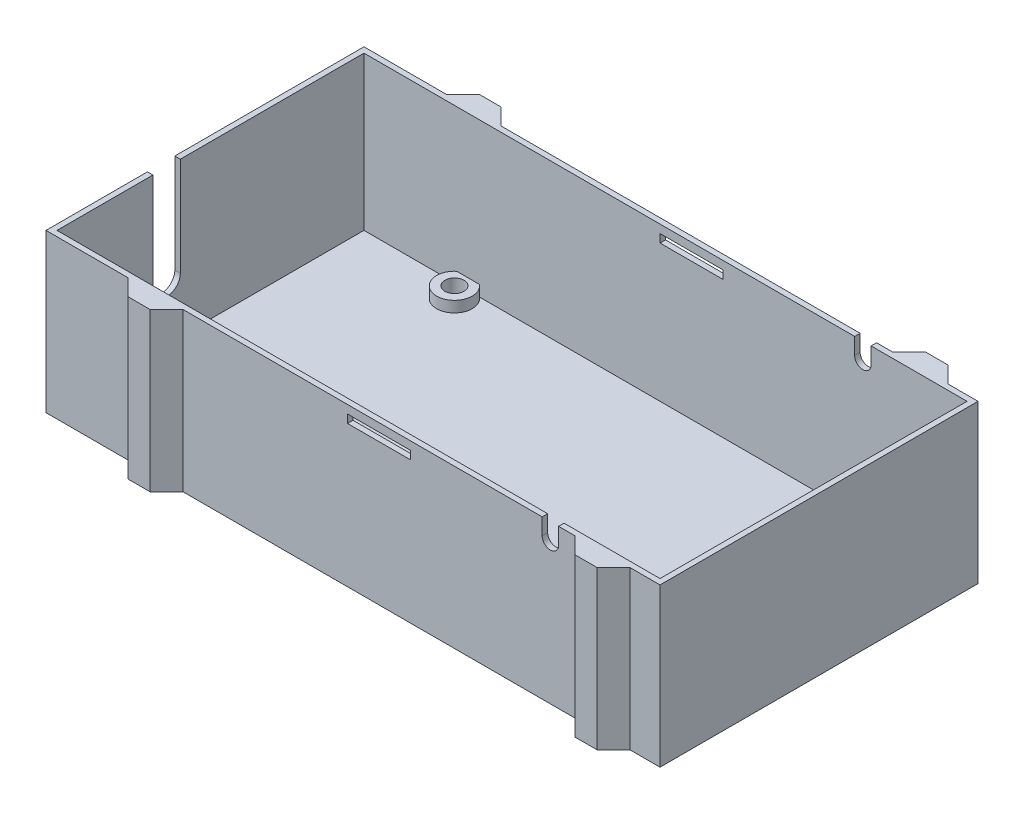
from build123d import *

# Parameters (mm, degrees)
SKETCH1_W           = 112
SKETCH1_H           = 58
BOSS_EXTRUDE1_DEPTH = 0.8
SKETCH2_W           = 112
SKETCH2_H           = 58
SKETCH2_W_2         = 110
SKETCH2_H_2         = 56
BOSS_EXTRUDE2_DEPTH = 28
SKETCH3_R           = 1.75
CUT_EXTRUDE1_DEPTH  = 28
BOSS_EXTRUDE3_START = 2
SKETCH4_R           = 3.25
SKETCH4_R_2         = 1.75
BOSS_EXTRUDE3_DEPTH = 2
CUT_EXTRUDE2_DEPTH  = 2
CUT_EXTRUDE3_DEPTH  = 72
BOSS_EXTRUDE4_DEPTH = 28.8
SKETCH8_W           = 11.5
SKETCH8_H           = 1.5
CUT_EXTRUDE4_DEPTH  = 70


with BuildPart() as part:
    # Sketch1 → Boss-Extrude1 (new body)
    with BuildSketch(Plane(origin=(0, 0, 0), x_dir=(1, 0, 0), z_dir=(0, 1, 0))):
        Rectangle(SKETCH1_W, SKETCH1_H)
    extrude(amount=BOSS_EXTRUDE1_DEPTH)

    # Sketch2 → Boss-Extrude2 (add)
    with BuildSketch(Plane(origin=(0, 0.8, 0), x_dir=(1, 0, 0), z_dir=(0, 1, 0))):
        Rectangle(SKETCH2_W, SKETCH2_H)
        Rectangle(SKETCH2_W_2, SKETCH2_H_2, mode=Mode.SUBTRACT)
    extrude(amount=BOSS_EXTRUDE2_DEPTH)

    # Sketch3 → Cut-Extrude1 (cut)
    with BuildSketch(Plane(origin=(0, 0.8, 0), x_dir=(1, 0, 0), z_dir=(0, 1, 0))):
        with Locations(Location((-36, 25.5, 0), (0, 0, 270))):
            Circle(SKETCH3_R)
        with Locations(Location((-36, -25.5, 0), (0, 0, 270))):
            Circle(SKETCH3_R)
        with Locations(Location((45.5, 25.5, 0), (0, 0, 270))):
            Circle(SKETCH3_R)
        with Locations(Location((45.5, -25.5, 0), (0, 0, 270))):
            Circle(SKETCH3_R)
    extrude(amount=-CUT_EXTRUDE1_DEPTH, mode=Mode.SUBTRACT)

    # Sketch4 → Boss-Extrude3 (add)
    # profile 1 of 4: a face of its own
    with BuildSketch(Plane(origin=(0, 0.8, 0), x_dir=(1, 0, 0), z_dir=(0, 1, 0)).offset(BOSS_EXTRUDE3_START)):
        with Locations((-36, 25.5)):
            Circle(SKETCH4_R)
        with Locations(Location((-36, 25.5, 0), (0, 0, 270))):
            Circle(SKETCH4_R_2, mode=Mode.SUBTRACT)
    # profile 2 of 4: a face of its own
    with BuildSketch(Plane(origin=(0, 0.8, 0), x_dir=(1, 0, 0), z_dir=(0, 1, 0)).offset(BOSS_EXTRUDE3_START)):
        with Locations((45.5, 25.5)):
            Circle(SKETCH4_R)
        with Locations(Location((45.5, 25.5, 0), (0, 0, 270))):
            Circle(SKETCH4_R_2, mode=Mode.SUBTRACT)
    # profile 3 of 4: a face of its own
    with BuildSketch(Plane(origin=(0, 0.8, 0), x_dir=(1, 0, 0), z_dir=(0, 1, 0)).offset(BOSS_EXTRUDE3_START)):
        with Locations((-36, -25.5)):
            Circle(SKETCH4_R)
        with Locations(Location((-36, -25.5, 0), (0, 0, 270))):
            Circle(SKETCH4_R_2, mode=Mode.SUBTRACT)
    # profile 4 of 4: a face of its own
    with BuildSketch(Plane(origin=(0, 0.8, 0), x_dir=(1, 0, 0), z_dir=(0, 1, 0)).offset(BOSS_EXTRUDE3_START)):
        with Locations((45.5, -25.5)):
            Circle(SKETCH4_R)
        with Locations(Location((45.5, -25.5, 0), (0, 0, 270))):
            Circle(SKETCH4_R_2, mode=Mode.SUBTRACT)
    extrude(amount=-BOSS_EXTRUDE3_DEPTH)

    # Sketch5 → Cut-Extrude2 (cut)
    with BuildSketch(Plane(origin=(-55, 0, 0), x_dir=(0, 0, -1), z_dir=(1, 0, 0))):
        with BuildLine():
            Line((-10.5, 28.8), (-10.5, 10.8))
            ThreePointArc((-10.5, 10.8), (-8, 8.3), (-5.5, 10.8))
            Line((-5.5, 10.8), (-5.5, 28.8))
            Line((-5.5, 28.8), (-10.5, 28.8))
        make_face()
    extrude(amount=-CUT_EXTRUDE2_DEPTH, mode=Mode.SUBTRACT)

    # Sketch6 → Cut-Extrude3 (cut)
    with BuildSketch(Plane.XY.offset(29)):
        with BuildLine():
            Line((34.5, 25.8), (34.5, 28.8))
            Line((34.5, 28.8), (37.5, 28.8))
            Line((37.5, 28.8), (37.5, 25.8))
            ThreePointArc((37.5, 25.8), (36, 24.3), (34.5, 25.8))
        make_face()
    extrude(amount=-CUT_EXTRUDE3_DEPTH, mode=Mode.SUBTRACT)

    # Sketch7 → Boss-Extrude4 (add)
    with BuildSketch(Plane.XZ):
        Polygon((-41, 29), (-38, 32), (-34, 32), (-31, 29), align=None)
        Polygon((40.5, 29), (43.5, 32), (47.5, 32), (50.5, 29), align=None)
        Polygon((-41, -29), (-38, -32), (-34, -32), (-31, -29), align=None)
        Polygon((40.5, -29), (43.5, -32), (47.5, -32), (50.5, -29), align=None)
    extrude(amount=-BOSS_EXTRUDE4_DEPTH)

    # Sketch8 → Cut-Extrude4 (cut)
    with BuildSketch(Plane.XY.offset(29)):
        with Locations((4.75, 26.55)):
            Rectangle(SKETCH8_W, SKETCH8_H)
    extrude(amount=-CUT_EXTRUDE4_DEPTH, mode=Mode.SUBTRACT)


solid = part.part
